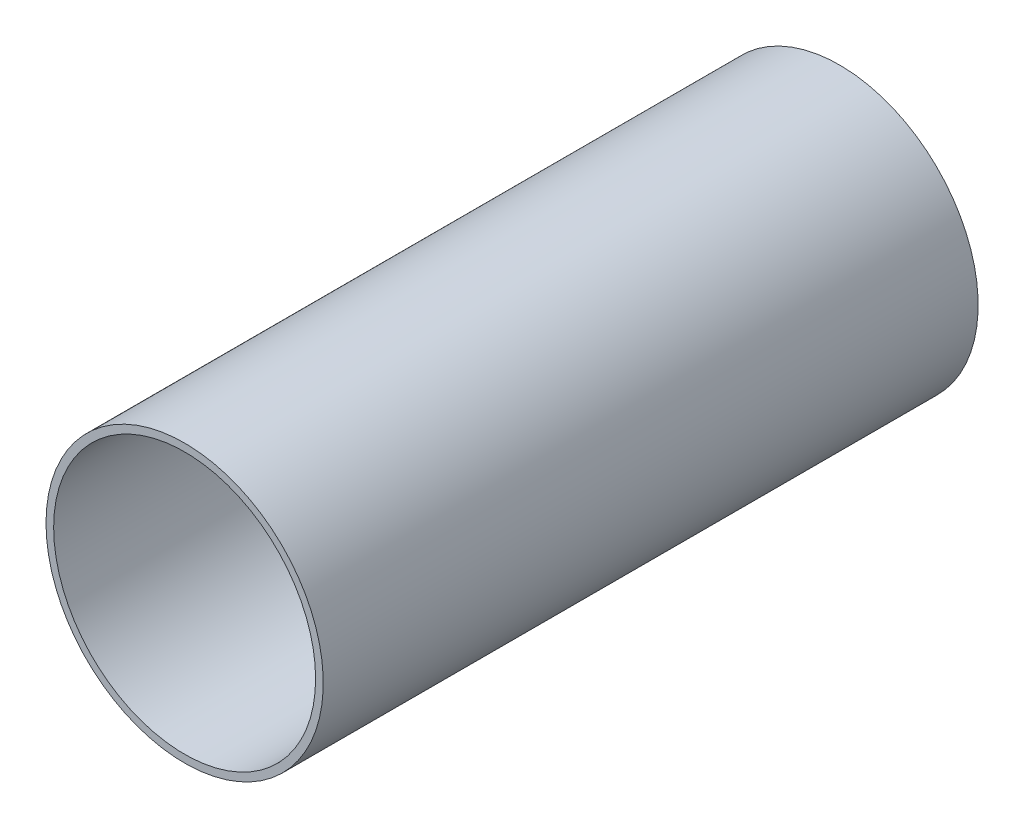
from build123d import *

# Parameters (mm, degrees)
SKETCH_1_R      = 19.05
SKETCH_1_R_2    = 18
EXTRUDE_1_DEPTH = 90


with BuildPart() as part:
    # 草圖1 → 填料-伸長1 (new body)
    with BuildSketch(Plane.XY):
        with Locations(Location((0, 0, 0), (0, 0, 180))):
            Circle(SKETCH_1_R)
        with Locations(Location((0, 0, 0), (0, 0, 180))):
            Circle(SKETCH_1_R_2, mode=Mode.SUBTRACT)
    extrude(amount=EXTRUDE_1_DEPTH)


solid = part.part
